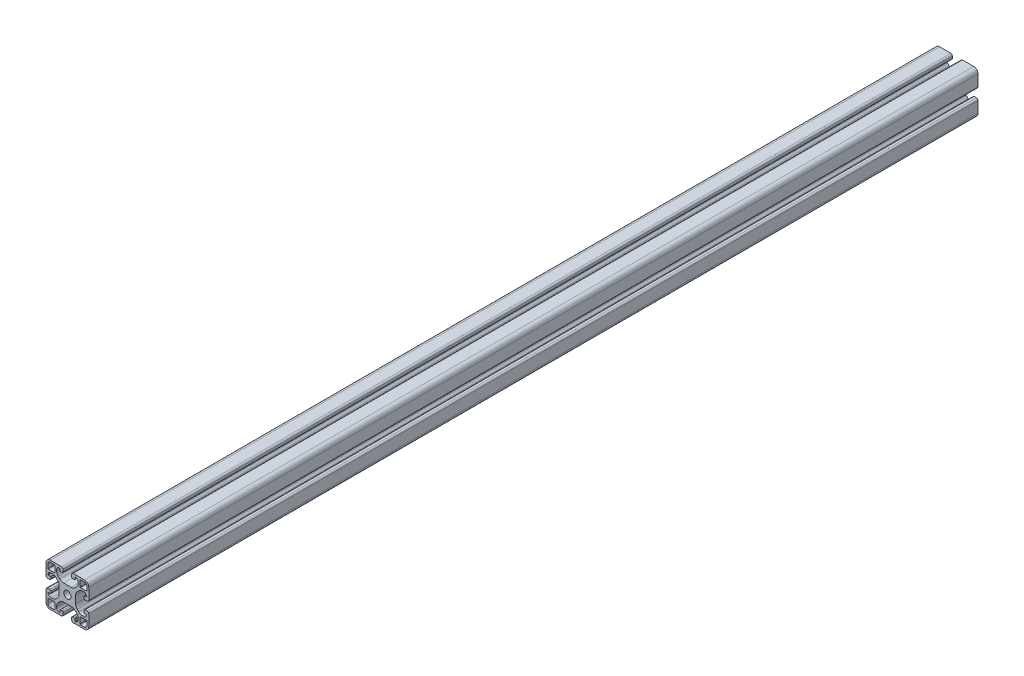
from build123d import *

# Parameters (mm, degrees)
ESQUISSE1_R        = 3.4
BOSS_EXTRU_1_DEPTH = 832


with BuildPart() as part:
    # Esquisse1 → Boss.-Extru.1 (new body)
    with BuildSketch(Plane(origin=(0, 0, -30), x_dir=(-1, 0, 0), z_dir=(0, 0, -1))):
        with BuildLine():
            Line((-4.5, 15), (-4.5, 13.5))
            ThreePointArc((-4.5, 13.5), (-4.353553391, 13.146446609), (-4, 13))
            Line((-4, 13), (-2.5, 13))
            ThreePointArc((-2.5, 13), (-2.146446609, 12.853553391), (-2, 12.5))
            ThreePointArc((-2, 12.5), (-2.732233047, 10.732233047), (-4.5, 10))
            Line((-4.5, 10), (-5.807611845, 10))
            ThreePointArc((-5.807611845, 10), (-7.721029006, 10.380602337), (-9.343145751, 11.464466094))
            Line((-9.343145751, 11.464466094), (-10.785533906, 12.906854249))
            ThreePointArc((-10.785533906, 12.906854249), (-11.869397663, 14.528970994), (-12.25, 16.442388155))
            Line((-12.25, 16.442388155), (-12.25, 23.557611845))
            ThreePointArc((-12.25, 23.557611845), (-11.869397663, 25.471029006), (-10.785533906, 27.093145751))
            Line((-10.785533906, 27.093145751), (-9.343145751, 28.535533906))
            ThreePointArc((-9.343145751, 28.535533906), (-7.721029006, 29.619397663), (-5.807611845, 30))
            Line((-5.807611845, 30), (-4.5, 30))
            ThreePointArc((-4.5, 30), (-2.732233047, 29.267766953), (-2, 27.5))
            ThreePointArc((-2, 27.5), (-2.146446609, 27.146446609), (-2.5, 27))
            Line((-2.5, 27), (-4, 27))
            ThreePointArc((-4, 27), (-4.353553391, 26.853553391), (-4.5, 26.5))
            Line((-4.5, 26.5), (-4.5, 25))
            ThreePointArc((-4.5, 25), (-4.207106781, 24.292893219), (-3.5, 24))
            Line((-3.5, 24), (-1.5, 24))
            ThreePointArc((-1.5, 24), (-0.439339828, 24.439339828), (0, 25.5))
            Line((0, 25.5), (0, 36))
            ThreePointArc((0, 36), (-1.171572875, 38.828427125), (-4, 40))
            Line((-4, 40), (-14.5, 40))
            ThreePointArc((-14.5, 40), (-15.560660172, 39.560660172), (-16, 38.5))
            Line((-16, 38.5), (-16, 36.5))
            ThreePointArc((-16, 36.5), (-15.707106781, 35.792893219), (-15, 35.5))
            Line((-15, 35.5), (-13.5, 35.5))
            ThreePointArc((-13.5, 35.5), (-13.146446609, 35.646446609), (-13, 36))
            Line((-13, 36), (-13, 37.5))
            ThreePointArc((-13, 37.5), (-12.853553391, 37.853553391), (-12.5, 38))
            ThreePointArc((-12.5, 38), (-10.732233047, 37.267766953), (-10, 35.5))
            Line((-10, 35.5), (-10, 34.192388155))
            ThreePointArc((-10, 34.192388155), (-10.380602337, 32.278970994), (-11.464466094, 30.656854249))
            Line((-11.464466094, 30.656854249), (-12.906854249, 29.214466094))
            ThreePointArc((-12.906854249, 29.214466094), (-14.528970994, 28.130602337), (-16.442388155, 27.75))
            Line((-16.442388155, 27.75), (-23.557611845, 27.75))
            ThreePointArc((-23.557611845, 27.75), (-25.471029006, 28.130602337), (-27.093145751, 29.214466094))
            Line((-27.093145751, 29.214466094), (-28.535533906, 30.656854249))
            ThreePointArc((-28.535533906, 30.656854249), (-29.619397663, 32.278970994), (-30, 34.192388155))
            Line((-30, 34.192388155), (-30, 35.5))
            ThreePointArc((-30, 35.5), (-29.267766953, 37.267766953), (-27.5, 38))
            ThreePointArc((-27.5, 38), (-27.146446609, 37.853553391), (-27, 37.5))
            Line((-27, 37.5), (-27, 36))
            ThreePointArc((-27, 36), (-26.853553391, 35.646446609), (-26.5, 35.5))
            Line((-26.5, 35.5), (-25, 35.5))
            ThreePointArc((-25, 35.5), (-24.292893219, 35.792893219), (-24, 36.5))
            Line((-24, 36.5), (-24, 38.5))
            ThreePointArc((-24, 38.5), (-24.439339828, 39.560660172), (-25.5, 40))
            Line((-25.5, 40), (-36, 40))
            ThreePointArc((-36, 40), (-38.828427125, 38.828427125), (-40, 36))
            Line((-40, 36), (-40, 25.5))
            ThreePointArc((-40, 25.5), (-39.560660172, 24.439339828), (-38.5, 24))
            Line((-38.5, 24), (-36.5, 24))
            ThreePointArc((-36.5, 24), (-35.792893219, 24.292893219), (-35.5, 25))
            Line((-35.5, 25), (-35.5, 26.5))
            ThreePointArc((-35.5, 26.5), (-35.646446609, 26.853553391), (-36, 27))
            Line((-36, 27), (-37.5, 27))
            ThreePointArc((-37.5, 27), (-37.853553391, 27.146446609), (-38, 27.5))
            ThreePointArc((-38, 27.5), (-37.267766953, 29.267766953), (-35.5, 30))
            Line((-35.5, 30), (-34.192388155, 30))
            ThreePointArc((-34.192388155, 30), (-32.278970994, 29.619397663), (-30.656854249, 28.535533906))
            Line((-30.656854249, 28.535533906), (-29.214466094, 27.093145751))
            ThreePointArc((-29.214466094, 27.093145751), (-28.130602337, 25.471029006), (-27.75, 23.557611845))
            Line((-27.75, 23.557611845), (-27.75, 16.442388155))
            ThreePointArc((-27.75, 16.442388155), (-28.130602337, 14.528970994), (-29.214466094, 12.906854249))
            Line((-29.214466094, 12.906854249), (-30.656854249, 11.464466094))
            ThreePointArc((-30.656854249, 11.464466094), (-32.278970994, 10.380602337), (-34.192388155, 10))
            Line((-34.192388155, 10), (-35.5, 10))
            ThreePointArc((-35.5, 10), (-37.267766953, 10.732233047), (-38, 12.5))
            ThreePointArc((-38, 12.5), (-37.853553391, 12.853553391), (-37.5, 13))
            Line((-37.5, 13), (-36, 13))
            ThreePointArc((-36, 13), (-35.646446609, 13.146446609), (-35.5, 13.5))
            Line((-35.5, 13.5), (-35.5, 15))
            ThreePointArc((-35.5, 15), (-35.792893219, 15.707106781), (-36.5, 16))
            Line((-36.5, 16), (-38.5, 16))
            ThreePointArc((-38.5, 16), (-39.560660172, 15.560660172), (-40, 14.5))
            Line((-40, 14.5), (-40, 4))
            ThreePointArc((-40, 4), (-38.828427125, 1.171572875), (-36, 0))
            Line((-36, 0), (-25.5, 0))
            ThreePointArc((-25.5, 0), (-24.439339828, 0.439339828), (-24, 1.5))
            Line((-24, 1.5), (-24, 3.5))
            ThreePointArc((-24, 3.5), (-24.292893219, 4.207106781), (-25, 4.5))
            Line((-25, 4.5), (-26.5, 4.5))
            ThreePointArc((-26.5, 4.5), (-26.853553391, 4.353553391), (-27, 4))
            Line((-27, 4), (-27, 2.5))
            ThreePointArc((-27, 2.5), (-27.146446609, 2.146446609), (-27.5, 2))
            ThreePointArc((-27.5, 2), (-29.267766953, 2.732233047), (-30, 4.5))
            Line((-30, 4.5), (-30, 5.807611845))
            ThreePointArc((-30, 5.807611845), (-29.619397663, 7.721029006), (-28.535533906, 9.343145751))
            Line((-28.535533906, 9.343145751), (-27.093145751, 10.785533906))
            ThreePointArc((-27.093145751, 10.785533906), (-25.471029006, 11.869397663), (-23.557611845, 12.25))
            Line((-23.557611845, 12.25), (-16.442388155, 12.25))
            ThreePointArc((-16.442388155, 12.25), (-14.528970994, 11.869397663), (-12.906854249, 10.785533906))
            Line((-12.906854249, 10.785533906), (-11.464466094, 9.343145751))
            ThreePointArc((-11.464466094, 9.343145751), (-10.380602337, 7.721029006), (-10, 5.807611845))
            Line((-10, 5.807611845), (-10, 4.5))
            ThreePointArc((-10, 4.5), (-10.732233047, 2.732233047), (-12.5, 2))
            ThreePointArc((-12.5, 2), (-12.853553391, 2.146446609), (-13, 2.5))
            Line((-13, 2.5), (-13, 4))
            ThreePointArc((-13, 4), (-13.146446609, 4.353553391), (-13.5, 4.5))
            Line((-13.5, 4.5), (-15, 4.5))
            ThreePointArc((-15, 4.5), (-15.707106781, 4.207106781), (-16, 3.5))
            Line((-16, 3.5), (-16, 1.5))
            ThreePointArc((-16, 1.5), (-15.560660172, 0.439339828), (-14.5, 0))
            Line((-14.5, 0), (-4, 0))
            ThreePointArc((-4, 0), (-1.171572875, 1.171572875), (0, 4))
            Line((0, 4), (0, 14.5))
            ThreePointArc((0, 14.5), (-0.439339828, 15.560660172), (-1.5, 16))
            Line((-1.5, 16), (-3.5, 16))
            ThreePointArc((-3.5, 16), (-4.207106781, 15.707106781), (-4.5, 15))
        make_face()
        with Locations((-20, 20)):
            Circle(ESQUISSE1_R, mode=Mode.SUBTRACT)
        with BuildLine():
            Line((-4, 1.8), (-7.7, 1.8))
            ThreePointArc((-7.7, 1.8), (-8.053553391, 1.946446609), (-8.2, 2.3))
            Line((-8.2, 2.3), (-8.2, 7.7))
            ThreePointArc((-8.2, 7.7), (-8.053553391, 8.053553391), (-7.7, 8.2))
            Line((-7.7, 8.2), (-2.3, 8.2))
            ThreePointArc((-2.3, 8.2), (-1.946446609, 8.053553391), (-1.8, 7.7))
            Line((-1.8, 7.7), (-1.8, 4))
            ThreePointArc((-1.8, 4), (-2.444365081, 2.444365081), (-4, 1.8))
        make_face(mode=Mode.SUBTRACT)
        with BuildLine():
            Line((-38.2, 4), (-38.2, 7.7))
            ThreePointArc((-38.2, 7.7), (-38.053553391, 8.053553391), (-37.7, 8.2))
            Line((-37.7, 8.2), (-32.3, 8.2))
            ThreePointArc((-32.3, 8.2), (-31.946446609, 8.053553391), (-31.8, 7.7))
            Line((-31.8, 7.7), (-31.8, 2.3))
            ThreePointArc((-31.8, 2.3), (-31.946446609, 1.946446609), (-32.3, 1.8))
            Line((-32.3, 1.8), (-36, 1.8))
            ThreePointArc((-36, 1.8), (-37.555634919, 2.444365081), (-38.2, 4))
        make_face(mode=Mode.SUBTRACT)
        with BuildLine():
            Line((-36, 38.2), (-32.3, 38.2))
            ThreePointArc((-32.3, 38.2), (-31.946446609, 38.053553391), (-31.8, 37.7))
            Line((-31.8, 37.7), (-31.8, 32.3))
            ThreePointArc((-31.8, 32.3), (-31.946446609, 31.946446609), (-32.3, 31.8))
            Line((-32.3, 31.8), (-37.7, 31.8))
            ThreePointArc((-37.7, 31.8), (-38.053553391, 31.946446609), (-38.2, 32.3))
            Line((-38.2, 32.3), (-38.2, 36))
            ThreePointArc((-38.2, 36), (-37.555634919, 37.555634919), (-36, 38.2))
        make_face(mode=Mode.SUBTRACT)
        with BuildLine():
            Line((-1.8, 36), (-1.8, 32.3))
            ThreePointArc((-1.8, 32.3), (-1.946446609, 31.946446609), (-2.3, 31.8))
            Line((-2.3, 31.8), (-7.7, 31.8))
            ThreePointArc((-7.7, 31.8), (-8.053553391, 31.946446609), (-8.2, 32.3))
            Line((-8.2, 32.3), (-8.2, 37.7))
            ThreePointArc((-8.2, 37.7), (-8.053553391, 38.053553391), (-7.7, 38.2))
            Line((-7.7, 38.2), (-4, 38.2))
            ThreePointArc((-4, 38.2), (-2.444365081, 37.555634919), (-1.8, 36))
        make_face(mode=Mode.SUBTRACT)
    extrude(amount=-BOSS_EXTRU_1_DEPTH)


solid = part.part
